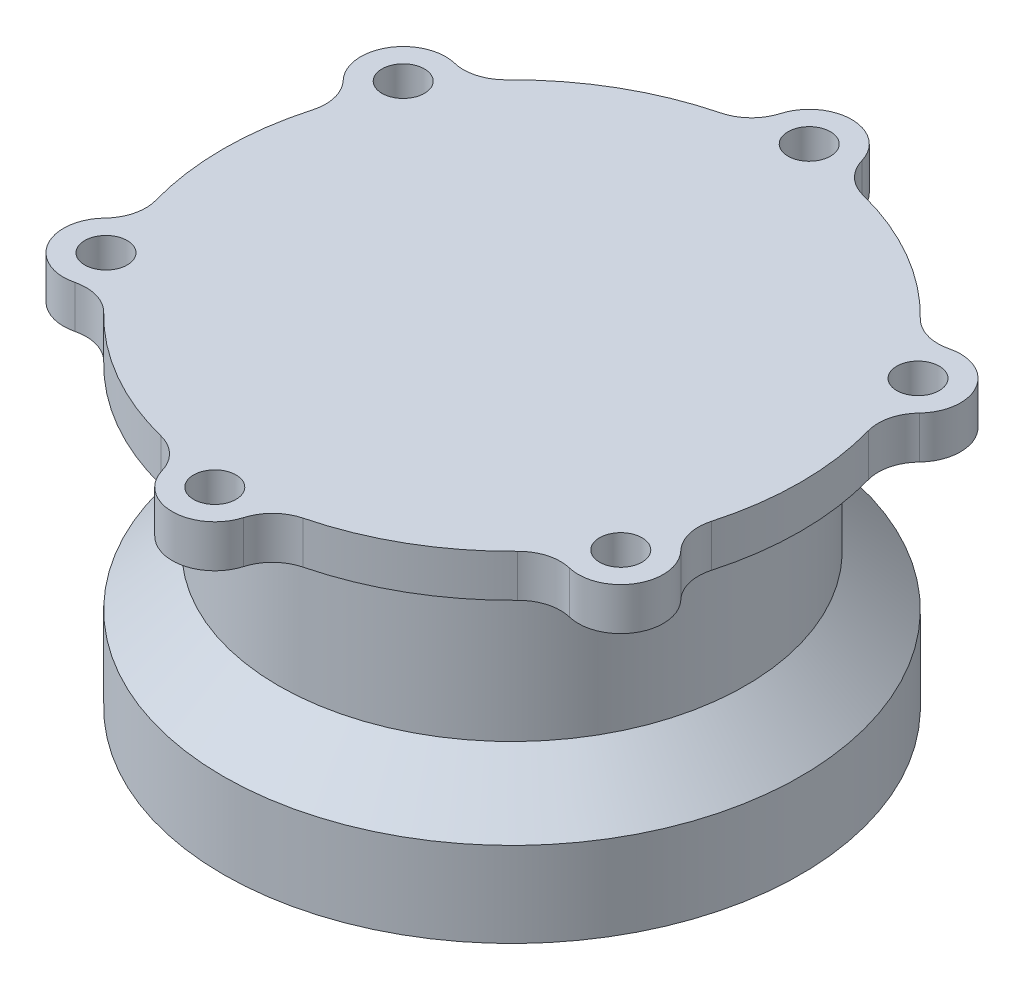
from build123d import *

# Parameters (mm, degrees)
BOSS_EXTRUDE2_START = 5
SKETCH2_R           = 2.5
BOSS_EXTRUDE2_DEPTH = 5
FILLET1_R           = 5


with BuildPart() as part:
    # Sketch3 → Revolve1 (revolve)
    with BuildSketch(Plane.XY, mode=Mode.PRIVATE) as revolve1_sk:
        Polygon((0, 0), (-34, 0), (-34, 10), (-27.5, 16), (-27.5, 35), (0, 35), align=None)
    revolve(revolve1_sk.sketch.rotate(Axis((0, 67.276563105, 0), (0, -1, 0)), 270), axis=Axis((0, 67.276563105, 0), (0, -1, 0)))

    # Sketch2 → Boss-Extrude2 (add)
    with BuildSketch(Plane(origin=(0, 35, 0), x_dir=(1, 0, 0), z_dir=(0, 1, 0)).offset(BOSS_EXTRUDE2_START)):
        with BuildLine():
            ThreePointArc((31.556090162, 12.657534265), (34.641016151, 20), (26.739791304, 20.999608592))
            ThreePointArc((26.739791304, 20.999608592), (17, 29.444863729), (4.816298858, 33.657142857))
            ThreePointArc((4.816298858, 33.657142857), (0, 40), (-4.816298858, 33.657142857))
            ThreePointArc((-4.816298858, 33.657142857), (-17, 29.444863729), (-26.739791304, 20.999608592))
            ThreePointArc((-26.739791304, 20.999608592), (-34.641016151, 20), (-31.556090162, 12.657534265))
            ThreePointArc((-31.556090162, 12.657534265), (-34, 0), (-31.556090162, -12.657534265))
            ThreePointArc((-31.556090162, -12.657534265), (-34.641016151, -20), (-26.739791304, -20.999608592))
            ThreePointArc((-26.739791304, -20.999608592), (-17, -29.444863729), (-4.816298858, -33.657142857))
            ThreePointArc((-4.816298858, -33.657142857), (0, -40), (4.816298858, -33.657142857))
            ThreePointArc((4.816298858, -33.657142857), (17, -29.444863729), (26.739791304, -20.999608592))
            ThreePointArc((26.739791304, -20.999608592), (34.641016151, -20), (31.556090162, -12.657534265))
            ThreePointArc((31.556090162, -12.657534265), (34, 0), (31.556090162, 12.657534265))
        make_face()
        with Locations(Location((-30.310889132, -17.5, 0), (0, 0, 270))):
            Circle(SKETCH2_R, mode=Mode.SUBTRACT)
        with Locations(Location((-30.310889132, 17.5, 0), (0, 0, 270))):
            Circle(SKETCH2_R, mode=Mode.SUBTRACT)
        with Locations(Location((0, -35, 0), (0, 0, 270))):
            Circle(SKETCH2_R, mode=Mode.SUBTRACT)
        with Locations(Location((0, 35, 0), (0, 0, 270))):
            Circle(SKETCH2_R, mode=Mode.SUBTRACT)
        with Locations(Location((30.310889132, -17.5, 0), (0, 0, 270))):
            Circle(SKETCH2_R, mode=Mode.SUBTRACT)
        with Locations(Location((30.310889132, 17.5, 0), (0, 0, 270))):
            Circle(SKETCH2_R, mode=Mode.SUBTRACT)
    extrude(amount=-BOSS_EXTRUDE2_DEPTH)

    # Fillet1
    fillet1_edges = [part.edges().sort_by_distance(p)[0] for p in [
        (-4.816298858, 37.5, 33.657142857),
        (4.816298858, 37.5, 33.657142857),
        (26.739791304, 37.5, 20.999608592),
        (31.556090162, 37.5, 12.657534265),
        (31.556090162, 37.5, -12.657534265),
        (26.739791304, 37.5, -20.999608592),
        (4.816298858, 37.5, -33.657142857),
        (-4.816298858, 37.5, -33.657142857),
        (-26.739791304, 37.5, -20.999608592),
        (-31.556090162, 37.5, -12.657534265),
        (-31.556090162, 37.5, 12.657534265),
        (-26.739791304, 37.5, 20.999608592),
    ]]
    fillet(fillet1_edges, radius=FILLET1_R)


solid = part.part
